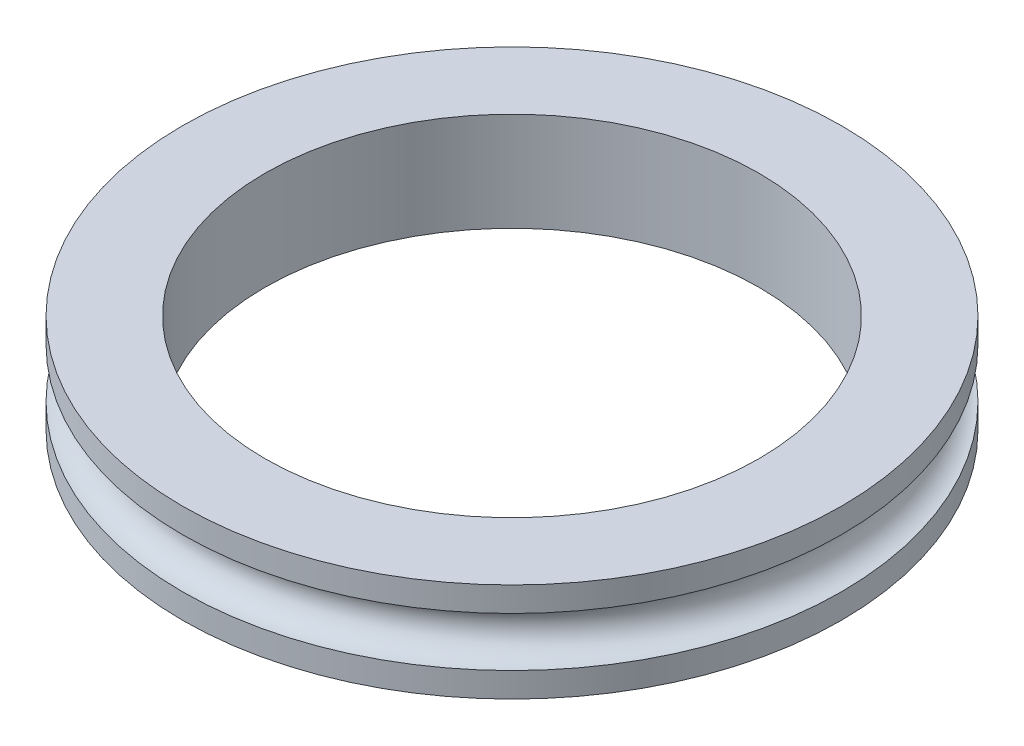
from build123d import *

# Parameters (mm, degrees)
CROQUIS1_R              = 10
SALIENTE_EXTRUIR1_DEPTH = 3
CROQUIS2_R              = 0.75
CROQUIS4_R              = 7.5
CORTAR_EXTRUIR1_DEPTH   = 15.456832295


with BuildPart() as part:
    # Croquis1 → Saliente-Extruir1 (new body)
    with BuildSketch(Plane(origin=(0, 0, 0), x_dir=(1, 0, 0), z_dir=(0, 1, 0))):
        with Locations(Location((0, 0, 0), (0, 0, 270))):
            Circle(CROQUIS1_R)
    extrude(amount=SALIENTE_EXTRUIR1_DEPTH)

    # Croquis2 → Cortar-Revolución1 (revolve, cut)
    with BuildSketch(Plane(origin=(0, 0, 0), x_dir=(0, 0, -1), z_dir=(1, 0, 0)), mode=Mode.PRIVATE) as cortar_revoluci_n1_sk:
        with Locations((10, 1.5)):
            Circle(CROQUIS2_R)
    revolve(cortar_revoluci_n1_sk.sketch.rotate(Axis((0, 3, 0), (0, -1, 0)), 180), axis=Axis((0, 3, 0), (0, -1, 0)), mode=Mode.SUBTRACT)

    # Croquis4 → Cortar-Extruir1 (cut, through all)
    with BuildSketch(Plane.XZ):
        with Locations(Location((0, 0, 0), (0, 0, 270))):
            Circle(CROQUIS4_R)
    extrude(amount=-CORTAR_EXTRUIR1_DEPTH, mode=Mode.SUBTRACT)


solid = part.part
